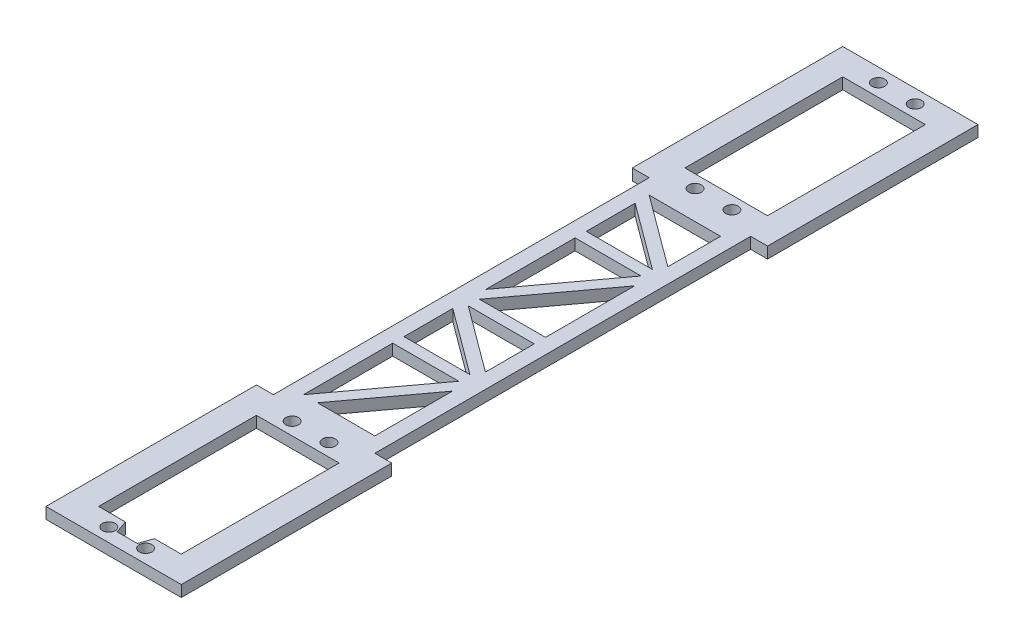
from build123d import *

# Parameters (mm, degrees)
SKETCH1_R           = 1.69
SKETCH1_R_2         = 1.689490446
BOSS_EXTRUDE1_DEPTH = 3


with BuildPart() as part:
    # Sketch1 → Boss-Extrude1 (new body)
    with BuildSketch(Plane(origin=(0, 0, 0), x_dir=(1, 0, 0), z_dir=(0, 1, 0))):
        Polygon((18, 28), (-18, 28), (-18, -28), (-13.5, -28), (-13.5, -128), (-18, -128), (-18, -184), (18, -184), (18, -128), (13.5, -128), (13.5, -28), (18, -28), align=None)
        with Locations(Location((-4.9, -131.61, 0), (0, 0, 270))):
            Circle(SKETCH1_R, mode=Mode.SUBTRACT)
        Polygon((-9.5, -124), (-9.5, -100.241284536), (8.065892483, -100.241284536), align=None, mode=Mode.SUBTRACT)
        Polygon((-9.5, -97.241284536), (-9.5, -84.254026063), (8.065892483, -97.241284536), align=None, mode=Mode.SUBTRACT)
        Polygon((-11, -135), (-4.9, -135), (4.9, -135), (11, -135), (11, -177), (3.865226591, -177), (2.682797031, -180.39), (-2.682797031, -180.39), (-3.865226591, -177), (-11, -177), align=None, mode=Mode.SUBTRACT)
        with Locations(Location((-4.9, -180.39, 0), (0, 0, 270))):
            Circle(SKETCH1_R, mode=Mode.SUBTRACT)
        with Locations(Location((4.9, -180.39, 0), (0, 0, 270))):
            Circle(SKETCH1_R, mode=Mode.SUBTRACT)
        with Locations(Location((4.9, -131.61, 0), (0, 0, 270))):
            Circle(SKETCH1_R, mode=Mode.SUBTRACT)
        Polygon((-5.769090987, -124), (9.5, -103.347819161), (9.5, -124), align=None, mode=Mode.SUBTRACT)
        Polygon((-8.065892483, -81.583417574), (9.5, -81.583417574), (9.5, -94.570676047), align=None, mode=Mode.SUBTRACT)
        Polygon((8.065892483, -51.718167486), (-9.5, -75.47688295), (-9.5, -51.718167486), align=None, mode=Mode.SUBTRACT)
        Polygon((-9.5, -48.718167486), (-9.5, -35.730909013), (8.065892483, -48.718167486), align=None, mode=Mode.SUBTRACT)
        Polygon((-9.5, -32), (9.5, -32), (9.5, -46.047558997), align=None, mode=Mode.SUBTRACT)
        with Locations(Location((-4.9, -24.389490446, 0), (0, 0, 270))):
            Circle(SKETCH1_R_2, mode=Mode.SUBTRACT)
        Polygon((-11, -21), (-11, 21), (-4.9, 21), (4.9, 21), (11, 21), (11, -21), (4.9, -21), align=None, mode=Mode.SUBTRACT)
        with Locations(Location((-4.9, 24.389490446, 0), (0, 0, 270))):
            Circle(SKETCH1_R_2, mode=Mode.SUBTRACT)
        Polygon((9.5, -54.82470211), (9.5, -78.583417574), (-8.065892483, -78.583417574), align=None, mode=Mode.SUBTRACT)
        with Locations(Location((4.9, -24.389490446, 0), (0, 0, 270))):
            Circle(SKETCH1_R_2, mode=Mode.SUBTRACT)
        with Locations(Location((4.9, 24.389490446, 0), (0, 0, 270))):
            Circle(SKETCH1_R_2, mode=Mode.SUBTRACT)
    extrude(amount=BOSS_EXTRUDE1_DEPTH)


solid = part.part
